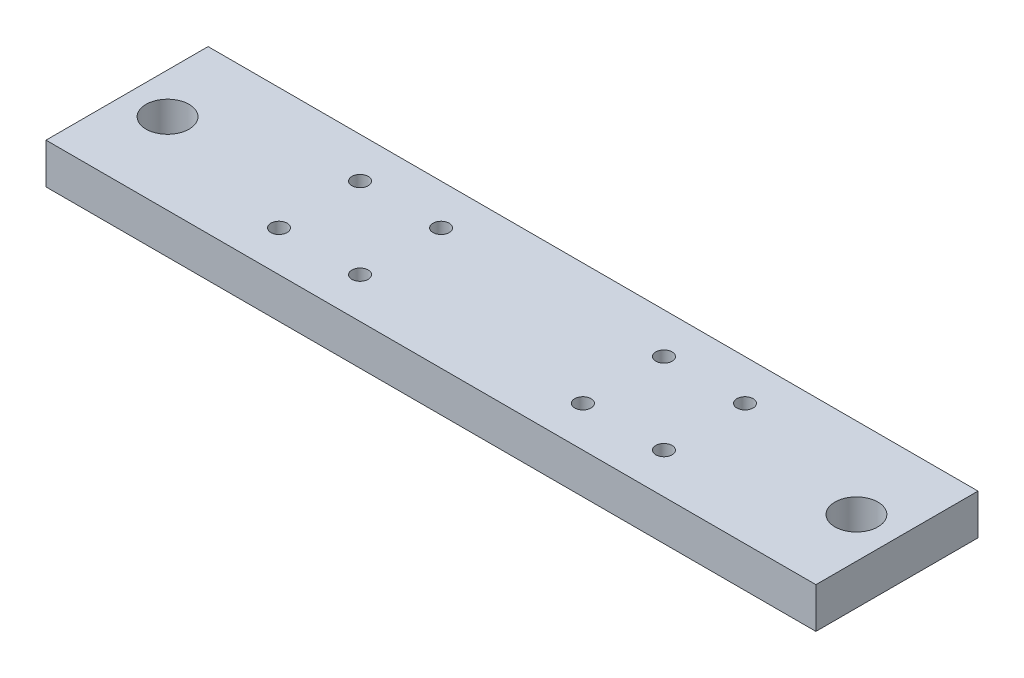
from build123d import *

# Parameters (mm, degrees)
SKETCH1_W               = 241.3
SKETCH1_H               = 50.8
BOSS_EXTRUDE1_DEPTH     = 12.7
F_1_4_20_TAPPED_HOLE2_D = 5.1054
F_1_2_CLEARANCE_HOLE1_D = 13.49248


with BuildPart() as part:
    # Sketch1 → Boss-Extrude1 (new body)
    with BuildSketch(Plane(origin=(0, 0, 0), x_dir=(1, 0, 0), z_dir=(0, 1, 0))):
        Rectangle(SKETCH1_W, SKETCH1_H)
    extrude(amount=BOSS_EXTRUDE1_DEPTH)

    # 1/4-20 Tapped Hole2 (through all)
    with Locations(Plane(origin=(0, 12.7, 0), x_dir=(1, 0, 0), z_dir=(0, 1, 0))):
        with Locations((60.325, -12.7), (-34.925, -12.7), (-60.325, -12.7), (-60.325, 12.7), (-34.925, 12.7), (34.925, 12.7), (60.325, 12.7), (34.925, -12.7)):
            Hole(F_1_4_20_TAPPED_HOLE2_D / 2)

    # 1/2 Clearance Hole1 (through all)
    with Locations(Plane(origin=(0, 12.7, 0), x_dir=(1, 0, 0), z_dir=(0, 1, 0))):
        with Locations((-107.95, 0), (107.95, 0)):
            Hole(F_1_2_CLEARANCE_HOLE1_D / 2)


solid = part.part
